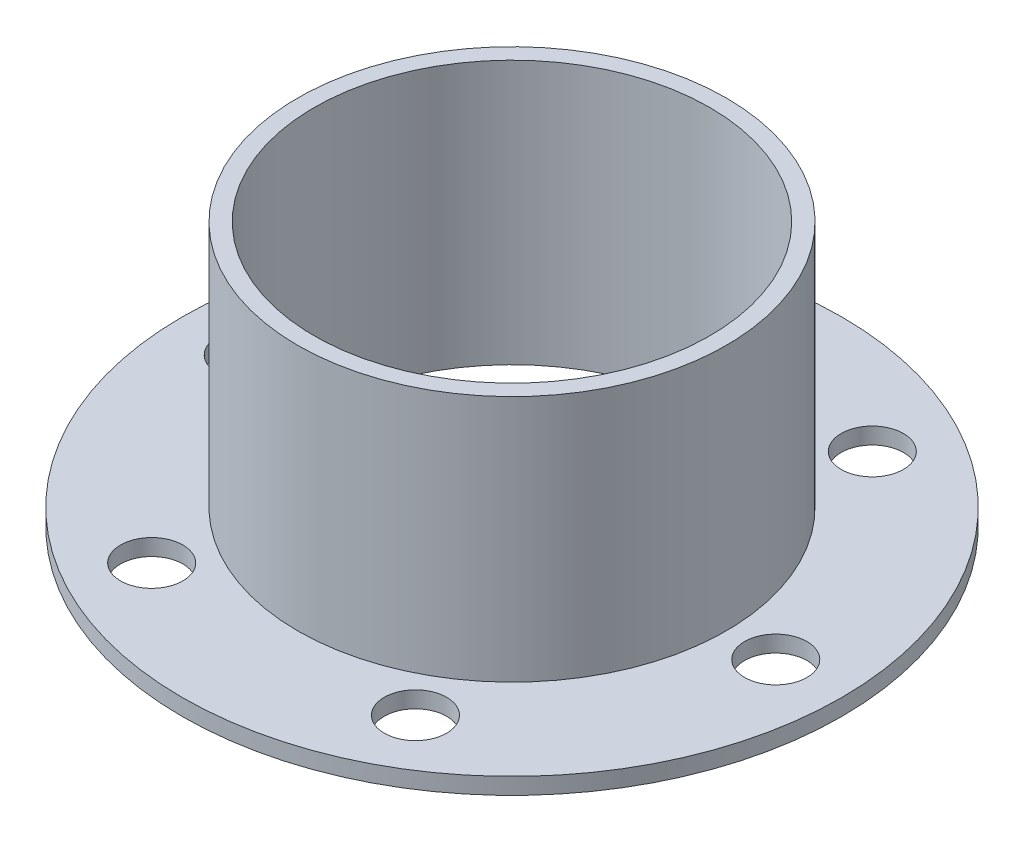
from build123d import *

# Parameters (mm, degrees)
SKETCH3_R          = 6
CUT_EXTRUDE1_DEPTH = 102.649597269
CIRPATTERN1_COUNT  = 6


with BuildPart() as part:
    # Sketch1 → Revolve1 (revolve)
    with BuildSketch(Plane.XY, mode=Mode.PRIVATE) as revolve1_sk:
        Polygon((-63.5, 0), (-63.5, 3.175), (-41.275, 3.175), (-41.275, 50.8), (-38.1, 50.8), (-38.1, 0), align=None)
    revolve(revolve1_sk.sketch.rotate(Axis((0, 0, 0), (0, 1, 0)), 270), axis=Axis((0, 0, 0), (0, 1, 0)))

    # Sketch3 → Cut-Extrude1 (cut, symmetric)
    with BuildSketch(Plane(origin=(0, 3.175, 0), x_dir=(1, 0, 0), z_dir=(0, 1, 0))):
        with Locations(Location((-50.8, 0, 0), (0, 0, 270))):
            Circle(SKETCH3_R)
    cut_extrude1 = extrude(amount=CUT_EXTRUDE1_DEPTH, both=True, mode=Mode.SUBTRACT)

    # CirPattern1: Cut-Extrude1 ×6 about axis
    cirpattern1_axis = Axis((0, 0, 0), (0, 1, 0))
    for i in range(1, CIRPATTERN1_COUNT):
        add(cut_extrude1.rotate(cirpattern1_axis, i * 360 / CIRPATTERN1_COUNT), mode=Mode.SUBTRACT)


solid = part.part
